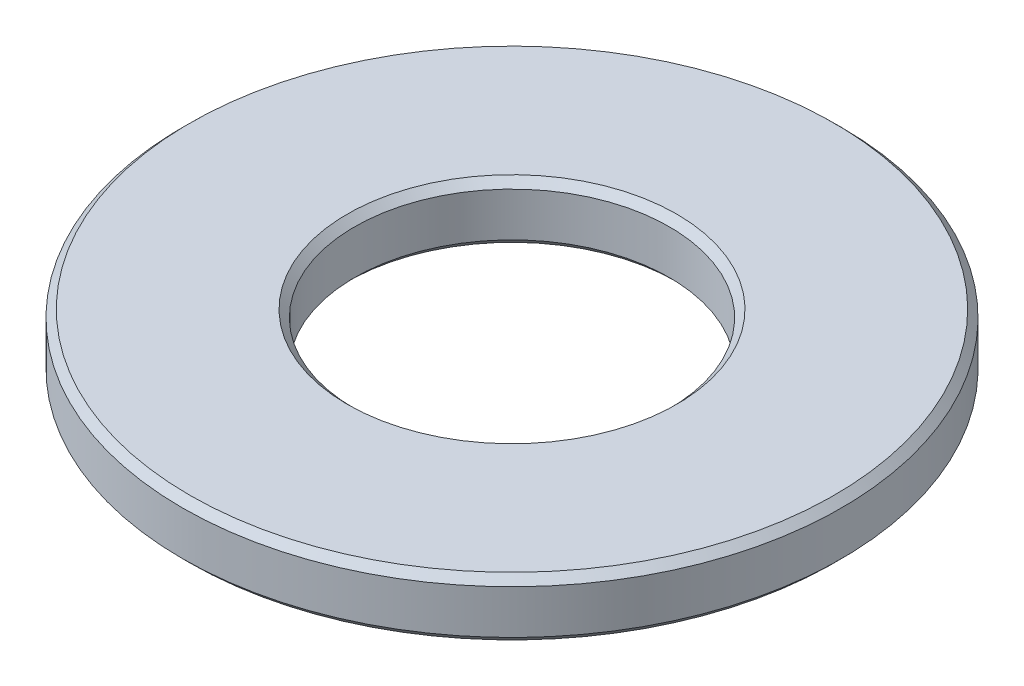
from build123d import *

# Parameters (mm, degrees)
SKETCH1_R           = 4.5
SKETCH1_R_2         = 2.15
BOSS_EXTRUDE1_DEPTH = 0.8
CHAMFER1_SIZE       = 0.1


with BuildPart() as part:
    # Sketch1 → Boss-Extrude1 (new body)
    with BuildSketch(Plane(origin=(0, 0, 0), x_dir=(1, 0, 0), z_dir=(0, 1, 0))):
        with Locations(Location((0, 0, 0), (0, 0, 270))):
            Circle(SKETCH1_R)
        with Locations(Location((0, 0, 0), (0, 0, 270))):
            Circle(SKETCH1_R_2, mode=Mode.SUBTRACT)
    extrude(amount=BOSS_EXTRUDE1_DEPTH)

    # Chamfer1
    chamfer1_edges = [part.edges().sort_by_distance(p)[0] for p in [
        (0, 0, -4.5),
        (0, 0.8, -4.5),
        (0, 0, -2.15),
        (0, 0.8, -2.15),
    ]]
    chamfer(chamfer1_edges, length=CHAMFER1_SIZE)


solid = part.part
